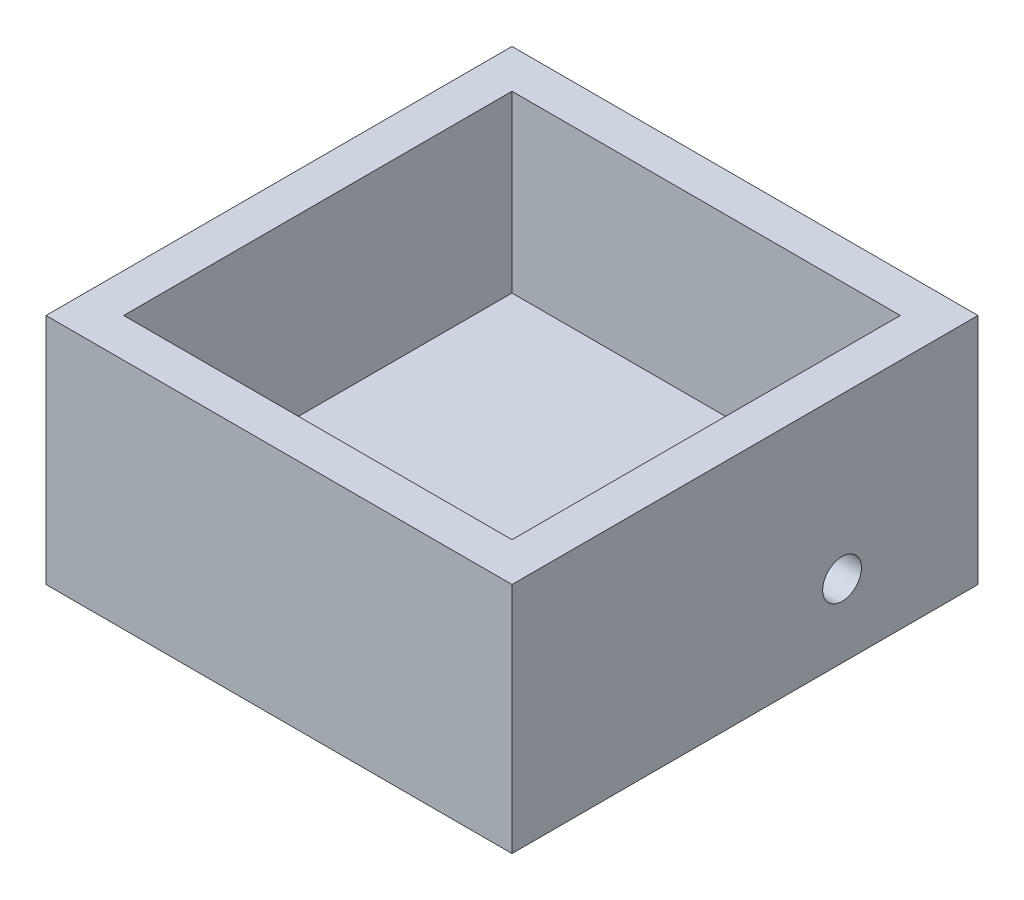
from build123d import *

# Parameters (mm, degrees)
SKETCH1_W           = 48
SKETCH1_H           = 48
SKETCH1_W_2         = 40
SKETCH1_H_2         = 40
BOSS_EXTRUDE1_DEPTH = 24
SKETCH1_5_W         = 40
SKETCH1_5_H         = 40
BOSS_EXTRUDE2_DEPTH = 4
SKETCH3_W           = 30
SKETCH3_H           = 30
BOSS_EXTRUDE3_DEPTH = 7
SKETCH4_R           = 2
CUT_EXTRUDE1_DEPTH  = 25


with BuildPart() as part:
    # Sketch1 → Boss-Extrude1 (new body)
    with BuildSketch(Plane(origin=(0, 0, 0), x_dir=(1, 0, 0), z_dir=(0, 1, 0))):
        Rectangle(SKETCH1_W, SKETCH1_H)
        Rectangle(SKETCH1_W_2, SKETCH1_H_2, mode=Mode.SUBTRACT)
    extrude(amount=BOSS_EXTRUDE1_DEPTH)

    # Sketch1<5> → Boss-Extrude2 (add)
    with BuildSketch(Plane(origin=(0, 0, 0), x_dir=(1, 0, 0), z_dir=(0, 1, 0))):
        Rectangle(SKETCH1_5_W, SKETCH1_5_H)
    extrude(amount=BOSS_EXTRUDE2_DEPTH)

    # Sketch3 → Boss-Extrude3 (add)
    with BuildSketch(Plane(origin=(0, 4, 0), x_dir=(1, 0, 0), z_dir=(0, 1, 0))):
        Rectangle(SKETCH3_W, SKETCH3_H)
    extrude(amount=BOSS_EXTRUDE3_DEPTH)

    # Sketch4 → Cut-Extrude1 (cut)
    with BuildSketch(Plane(origin=(24, 0, 0), x_dir=(0, 0, -1), z_dir=(1, 0, 0))):
        with Locations((10, 7.5)):
            Circle(SKETCH4_R)
    extrude(amount=-CUT_EXTRUDE1_DEPTH, mode=Mode.SUBTRACT)


solid = part.part
